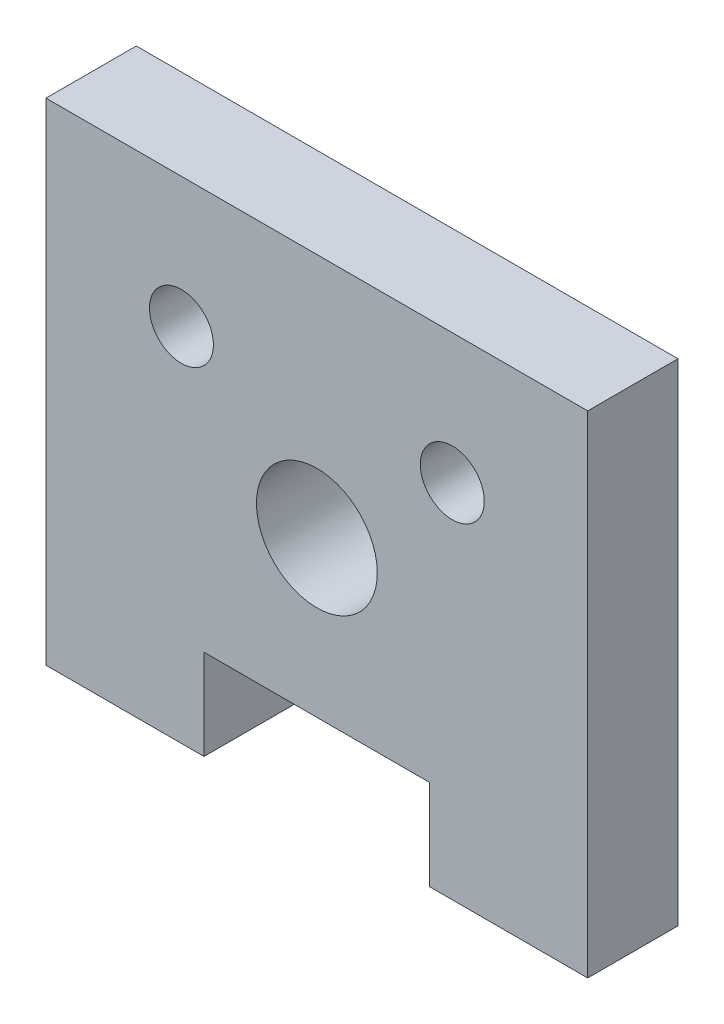
from build123d import *

# Parameters (mm, degrees)
SKETCH1_R           = 8.5
SKETCH1_R_2         = 4.5
BOSS_EXTRUDE1_DEPTH = 12.7


with BuildPart() as part:
    # Sketch1 → Boss-Extrude1 (new body)
    with BuildSketch(Plane.XY):
        Polygon((-15.875, -34.544), (-15.875, -21.844), (15.875, -21.844), (15.875, -34.544), (38.1, -34.544), (38.1, 34.544), (-38.1, 34.544), (-38.1, -34.544), align=None)
        Circle(SKETCH1_R, mode=Mode.SUBTRACT)
        with Locations((19.05, 16.256)):
            Circle(SKETCH1_R_2, mode=Mode.SUBTRACT)
        with Locations((-19.05, 16.256)):
            Circle(SKETCH1_R_2, mode=Mode.SUBTRACT)
    extrude(amount=BOSS_EXTRUDE1_DEPTH)


solid = part.part
